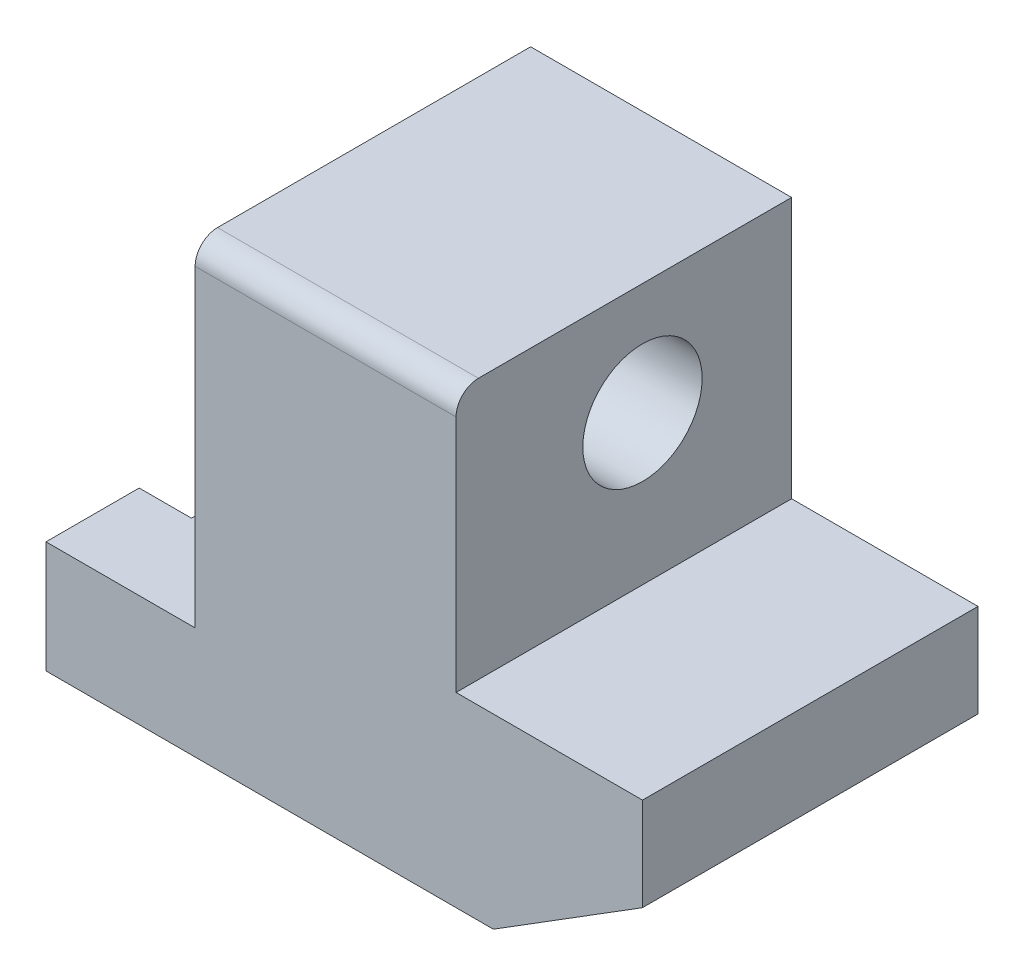
from build123d import *

# Parameters (mm, degrees)
ESBO_O1_W                = 25
ESBO_O1_H                = 30
ESBO_O1_W_2              = 40
RESSALTO_EXTRUS_O2_DEPTH = 40
RESSALTO_EXTRUS_O3_DEPTH = 90
ESBO_O3_R                = 16
CORTE_EXTRUS_O1_DEPTH    = 193.093727123
FILETE1_R                = 6
ESBO_O4_W                = 40
ESBO_O4_H                = 30
CORTE_EXTRUS_O2_DEPTH    = 14
CORTE_EXTRUS_O3_DEPTH    = 220.317121995


with BuildPart() as part:
    # Esboço1 → Ressalto-extrusão2 (new body)
    with BuildSketch(Plane(origin=(0, 0, 0), x_dir=(0, 0, -1), z_dir=(1, 0, 0))):
        with Locations((12.5, 15)):
            Rectangle(ESBO_O1_W, ESBO_O1_H)
        with Locations((77.5, 15)):
            Rectangle(ESBO_O1_W, ESBO_O1_H)
        with Locations((45, 15)):
            Rectangle(ESBO_O1_W_2, ESBO_O1_H)
    extrude(amount=RESSALTO_EXTRUS_O2_DEPTH)

    # Esboço2 → Ressalto-extrusão3 (add)
    with BuildSketch(Plane.XY):
        Polygon((40, 30), (40, 120), (110, 120), (110, 104.242681345), (110, 50), (160, 50), (160, 0), (120, 0), (40, 0), align=None)
    extrude(amount=-RESSALTO_EXTRUS_O3_DEPTH)

    # Esboço3 → Corte-extrusão1 (cut, through all)
    with BuildSketch(Plane.ZY.offset(-40)):
        with Locations((-50, 90)):
            Circle(ESBO_O3_R)
    extrude(amount=-CORTE_EXTRUS_O1_DEPTH, mode=Mode.SUBTRACT)

    # Filete1
    filete1_edges = [part.edges().sort_by_distance(p)[0] for p in [
        (75, 120, 0),
    ]]
    fillet(filete1_edges, radius=FILETE1_R)

    # Esboço4 → Corte-extrusão2 (cut)
    with BuildSketch(Plane.ZY):
        with Locations((-45, 15)):
            Rectangle(ESBO_O4_W, ESBO_O4_H)
    extrude(amount=-CORTE_EXTRUS_O2_DEPTH, mode=Mode.SUBTRACT)

    # Esboço5 → Corte-extrusão3 (cut, through all)
    with BuildSketch(Plane.XY):
        Polygon((120, 0), (160, 25), (160, 0), align=None)
    extrude(amount=-CORTE_EXTRUS_O3_DEPTH, mode=Mode.SUBTRACT)


solid = part.part
